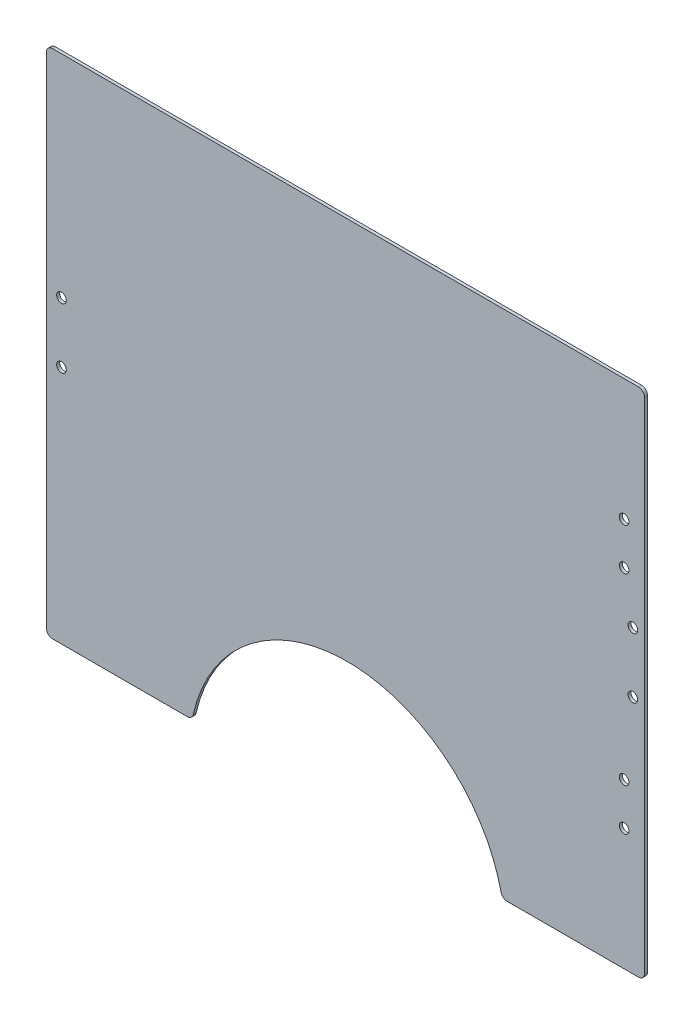
from build123d import *

# Parameters (mm, degrees)
SKETCH_1_W          = 200
SKETCH_1_H          = 170
EXTRUDE_1_DEPTH     = 1
SKETCH_2_R          = 52.5
CUT_EXTRUDE_1_DEPTH = 2
SKETCH_3_R          = 1.6
CUT_EXTRUDE_2_DEPTH = 1
SKETCH_6_W          = 1.1
SKETCH_6_H          = 170
CUT_EXTRUDE_4_DEPTH = 10
FILLET_1_R          = 2
SKETCH_8_R          = 1.6
CUT_EXTRUDE_5_DEPTH = 10


with BuildPart() as part:
    # 草图1 → 凸台-拉伸1 (new body)
    with BuildSketch(Plane.XY):
        Rectangle(SKETCH_1_W, SKETCH_1_H)
    extrude(amount=EXTRUDE_1_DEPTH)

    # 草图2 → 切除-拉伸1 (cut)
    with BuildSketch(Plane(origin=(0, 0, 0), x_dir=(-1, 0, 0), z_dir=(0, 0, -1))):
        with Locations((0, -95)):
            Circle(SKETCH_2_R)
    extrude(amount=-CUT_EXTRUDE_1_DEPTH, mode=Mode.SUBTRACT)

    # 草图3 → 切除-拉伸2 (cut)
    with BuildSketch(Plane(origin=(0, 0, 0), x_dir=(-1, 0, 0), z_dir=(0, 0, -1))):
        with Locations((95, 14.722484501)):
            Circle(SKETCH_3_R)
        with Locations((95, -5.277515499)):
            Circle(SKETCH_3_R)
    cut_extrude_2 = extrude(amount=-CUT_EXTRUDE_2_DEPTH, mode=Mode.SUBTRACT)

    # 镜向1: 切除-拉伸2 across plane
    add(cut_extrude_2.mirror(Plane(origin=(0, 0, 0), x_dir=(0, 0, 1), z_dir=(1, 0, 0))), mode=Mode.SUBTRACT)

    # 草图6 → 切除-拉伸4 (cut)
    with BuildSketch(Plane(origin=(0, 0, 0), x_dir=(-1, 0, 0), z_dir=(0, 0, -1))):
        with Locations((-99.45, 0)):
            Rectangle(SKETCH_6_W, SKETCH_6_H)
    extrude(amount=-CUT_EXTRUDE_4_DEPTH, mode=Mode.SUBTRACT)

    # 圆角1
    fillet_1_edges = [part.edges().sort_by_distance(p)[0] for p in [
        (51.53882032, -85, 0.5),
        (-51.53882032, -85, 0.5),
        (98.9, 85, 0.5),
        (98.9, -85, 0.5),
        (-100, -85, 0.5),
        (-100, 85, 0.5),
    ]]
    fillet(fillet_1_edges, radius=FILLET_1_R)

    # 草图8 → 切除-拉伸5 (cut)
    with BuildSketch(Plane(origin=(0, 0, 0), x_dir=(-1, 0, 0), z_dir=(0, 0, -1))):
        with Locations((-92.1, 44.5)):
            Circle(SKETCH_8_R)
        with Locations((-92.1, 30.5)):
            Circle(SKETCH_8_R)
        with Locations((-92.1, -30.5)):
            Circle(SKETCH_8_R)
        with Locations((-92.1, -44.5)):
            Circle(SKETCH_8_R)
    extrude(amount=-CUT_EXTRUDE_5_DEPTH, mode=Mode.SUBTRACT)


solid = part.part
